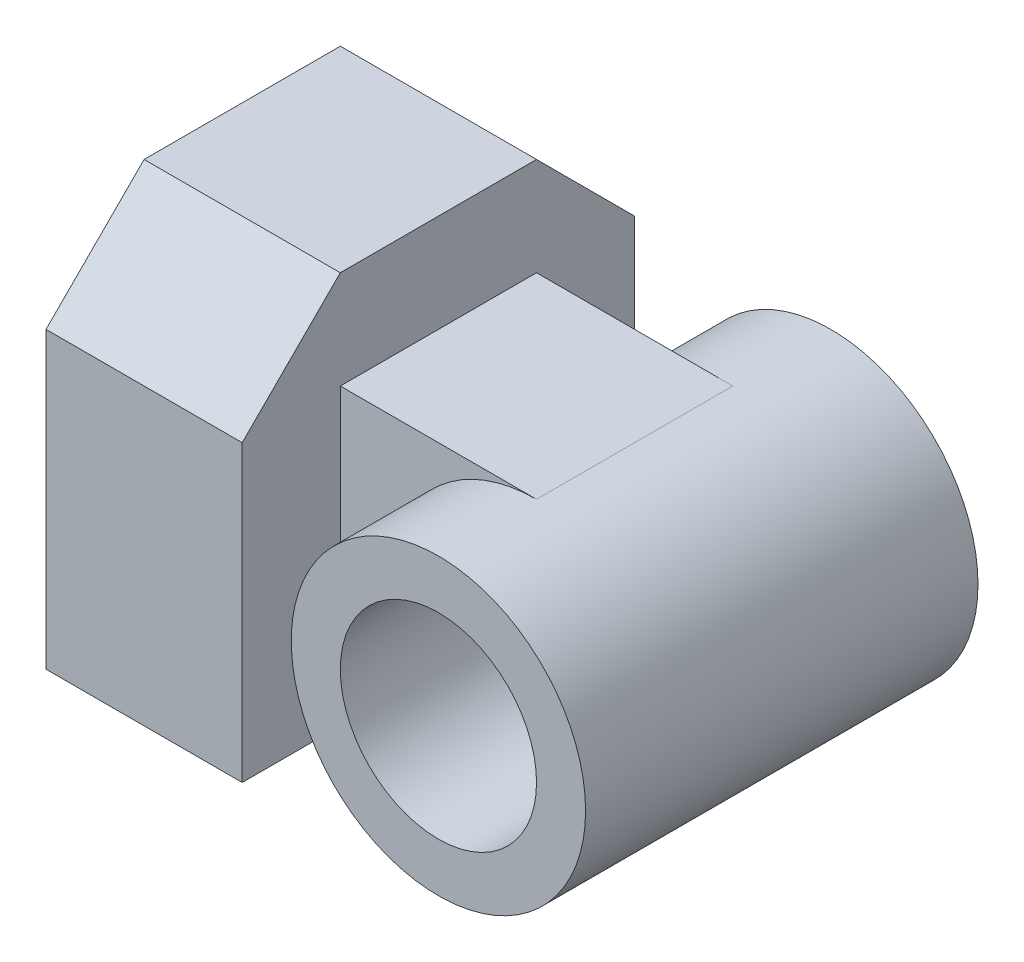
from build123d import *

# Parameters (mm, degrees)
SKETCH2_W           = 50.8
SKETCH2_H           = 101.6
BOSS_EXTRUDE1_DEPTH = 50.8
SKETCH3_W           = 50.8
SKETCH3_H           = 76.2
BOSS_EXTRUDE2_DEPTH = 50.8
BOSS_EXTRUDE3_REACH = 138.783
SKETCH4_R           = 38.1
CHAMFER2_SIZE       = 25.4
HOLE1_D             = 50.8


with BuildPart() as part:
    # Sketch2 → Boss-Extrude1 (new, symmetric)
    with BuildSketch(Plane.XY):
        Rectangle(SKETCH2_W, SKETCH2_H)
    extrude(amount=BOSS_EXTRUDE1_DEPTH, both=True)

    # Sketch3 → Boss-Extrude2 (add)
    with BuildSketch(Plane(origin=(76.2, 0, 0), x_dir=(0, 0, -1), z_dir=(1, 0, 0))):
        with Locations((0, -12.7)):
            Rectangle(SKETCH3_W, SKETCH3_H)
    extrude(amount=-BOSS_EXTRUDE2_DEPTH)

    # Boss-Extrude3: up to this face of the body (flat: up to its plane)
    boss_extrude3_end = Plane(part.part.faces().sort_by_distance((0, 0, -50.8))[0])
    # Sketch4 → Boss-Extrude3 (add, up to the picked face)
    with BuildSketch(Plane.XY.offset(50.8), mode=Mode.PRIVATE) as boss_extrude3_sk1:
        with Locations((76.2, -12.7)):
            Circle(SKETCH4_R)
    boss_extrude3_tool1 = split(extrude(boss_extrude3_sk1.sketch, amount=-BOSS_EXTRUDE3_REACH, mode=Mode.PRIVATE), bisect_by=boss_extrude3_end, keep=Keep.BOTH, mode=Mode.PRIVATE)
    add(boss_extrude3_tool1.solids().sort_by(Axis((76.2, -12.7, 50.8), (0, 0, -1)))[0])

    # Chamfer2
    chamfer2_edges = [part.edges().sort_by_distance(p)[0] for p in [
        (0, 50.8, -50.8),
        (0, 50.8, 50.8),
    ]]
    chamfer(chamfer2_edges, length=CHAMFER2_SIZE)

    # Hole1 (through all)
    with Locations(Plane(origin=(76.2, -12.7, 50.8), x_dir=(1, 0, 0), z_dir=(0, 0, 1))):
        with Locations((0, 0)):
            Hole(HOLE1_D / 2)


solid = part.part
